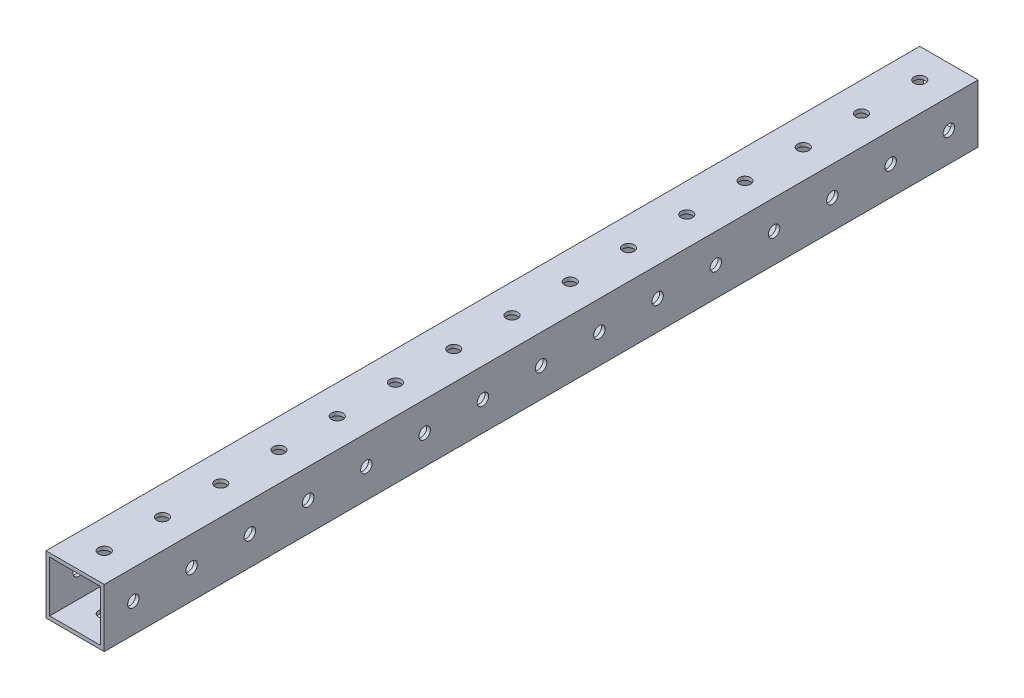
from build123d import *

# Parameters (mm, degrees)
SKETCH1_W           = 25.4
SKETCH1_H           = 25.4
BOSS_EXTRUDE1_DEPTH = 381
SHELL1_T            = -1.5875
SKETCH2_R           = 2.4892
CUT_EXTRUDE1_DEPTH  = 383.689587002
SKETCH3_R           = 2.4892
CUT_EXTRUDE2_DEPTH  = 383.689587002


with BuildPart() as part:
    # Sketch1 → Boss-Extrude1 (new body)
    with BuildSketch(Plane.XY):
        with Locations((12.7, 12.7)):
            Rectangle(SKETCH1_W, SKETCH1_H)
    extrude(amount=-BOSS_EXTRUDE1_DEPTH)

    # Shell1
    shell1_openings = [part.faces().sort_by_distance(p)[0] for p in [
        (12.7, 12.7, -381),
        (12.7, 12.7, 0),
    ]]
    offset(amount=SHELL1_T, openings=shell1_openings, kind=Kind.INTERSECTION)

    # Sketch2 → Cut-Extrude1 (cut, through all)
    with BuildSketch(Plane(origin=(25.4, 0, 0), x_dir=(0, 0, -1), z_dir=(1, 0, 0))):
        with Locations(Location((12.7, 12.7, 0), (0, 0, 90))):
            Circle(SKETCH2_R)
        with Locations(Location((38.1, 12.7, 0), (0, 0, 90))):
            Circle(SKETCH2_R)
        with Locations(Location((63.5, 12.7, 0), (0, 0, 90))):
            Circle(SKETCH2_R)
        with Locations(Location((88.9, 12.7, 0), (0, 0, 90))):
            Circle(SKETCH2_R)
        with Locations(Location((114.3, 12.7, 0), (0, 0, 90))):
            Circle(SKETCH2_R)
        with Locations(Location((139.7, 12.7, 0), (0, 0, 90))):
            Circle(SKETCH2_R)
        with Locations(Location((165.1, 12.7, 0), (0, 0, 90))):
            Circle(SKETCH2_R)
        with Locations(Location((190.5, 12.7, 0), (0, 0, 90))):
            Circle(SKETCH2_R)
        with Locations(Location((215.9, 12.7, 0), (0, 0, 90))):
            Circle(SKETCH2_R)
        with Locations(Location((241.3, 12.7, 0), (0, 0, 90))):
            Circle(SKETCH2_R)
        with Locations(Location((266.7, 12.7, 0), (0, 0, 90))):
            Circle(SKETCH2_R)
        with Locations(Location((292.1, 12.7, 0), (0, 0, 90))):
            Circle(SKETCH2_R)
        with Locations(Location((317.5, 12.7, 0), (0, 0, 90))):
            Circle(SKETCH2_R)
        with Locations(Location((342.9, 12.7, 0), (0, 0, 90))):
            Circle(SKETCH2_R)
        with Locations(Location((368.3, 12.7, 0), (0, 0, 90))):
            Circle(SKETCH2_R)
    extrude(amount=-CUT_EXTRUDE1_DEPTH, mode=Mode.SUBTRACT)

    # Sketch3 → Cut-Extrude2 (cut, through all)
    with BuildSketch(Plane(origin=(0, 25.4, 0), x_dir=(1, 0, 0), z_dir=(0, 1, 0))):
        with Locations(Location((12.7, 12.7, 0), (0, 0, 270))):
            Circle(SKETCH3_R)
        with Locations(Location((12.7, 38.1, 0), (0, 0, 270))):
            Circle(SKETCH3_R)
        with Locations(Location((12.7, 63.5, 0), (0, 0, 270))):
            Circle(SKETCH3_R)
        with Locations(Location((12.7, 88.9, 0), (0, 0, 270))):
            Circle(SKETCH3_R)
        with Locations(Location((12.7, 114.3, 0), (0, 0, 270))):
            Circle(SKETCH3_R)
        with Locations(Location((12.7, 139.7, 0), (0, 0, 270))):
            Circle(SKETCH3_R)
        with Locations(Location((12.7, 165.1, 0), (0, 0, 270))):
            Circle(SKETCH3_R)
        with Locations(Location((12.7, 190.5, 0), (0, 0, 270))):
            Circle(SKETCH3_R)
        with Locations(Location((12.7, 215.9, 0), (0, 0, 270))):
            Circle(SKETCH3_R)
        with Locations(Location((12.7, 241.3, 0), (0, 0, 270))):
            Circle(SKETCH3_R)
        with Locations(Location((12.7, 266.7, 0), (0, 0, 270))):
            Circle(SKETCH3_R)
        with Locations(Location((12.7, 292.1, 0), (0, 0, 270))):
            Circle(SKETCH3_R)
        with Locations(Location((12.7, 317.5, 0), (0, 0, 270))):
            Circle(SKETCH3_R)
        with Locations(Location((12.7, 342.9, 0), (0, 0, 270))):
            Circle(SKETCH3_R)
        with Locations(Location((12.7, 368.3, 0), (0, 0, 270))):
            Circle(SKETCH3_R)
    extrude(amount=-CUT_EXTRUDE2_DEPTH, mode=Mode.SUBTRACT)


solid = part.part
